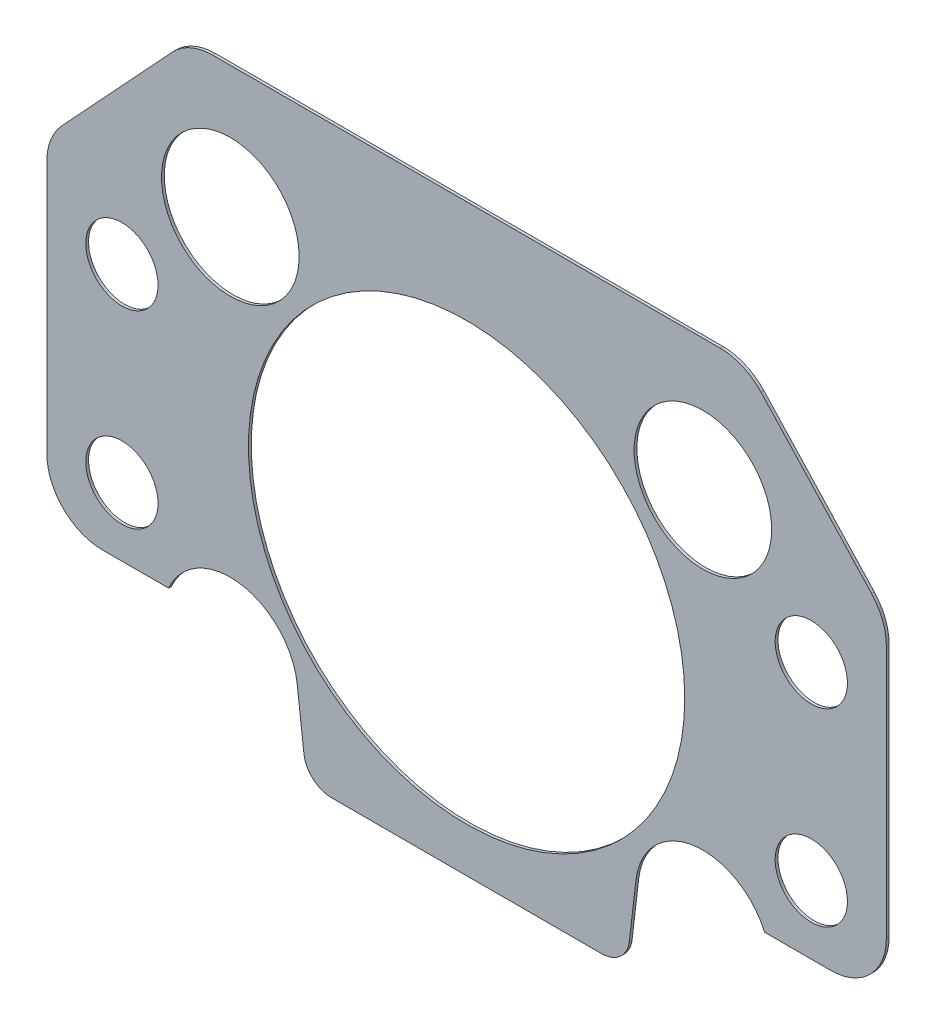
from build123d import *

# Parameters (mm, degrees)
SKETCH1_R           = 24.75
SKETCH1_R_2         = 13
SKETCH1_R_3         = 78.475
BOSS_EXTRUDE1_DEPTH = 1


with BuildPart() as part:
    # Sketch1 → Boss-Extrude1 (new body)
    with BuildSketch(Plane.XY):
        with BuildLine():
            Line((-2.561737691, 115.5), (-91.270303138, 115.5))
            ThreePointArc((-91.270303138, 115.5), (-99.271058557, 113.829973069), (-105.935666275, 109.098791272))
            Line((-105.935666275, 109.098791272), (-145.665363137, 66.253039754))
            ThreePointArc((-145.665363137, 66.253039754), (-149.618636668, 59.958108327), (-151, 52.654248482))
            Line((-151, 52.654248482), (-151, -38.5))
            ThreePointArc((-151, -38.5), (-145.142135624, -52.642135624), (-131, -58.5))
            Line((-131, -58.5), (-107.203603311, -58.5))
            ThreePointArc((-107.203603311, -58.5), (-81.413958175, -44.266614), (-60.915571747, -65.421075164))
            Line((-60.915571747, -65.421075164), (-58.537563271, -85.666566943))
            ThreePointArc((-58.537563271, -85.666566943), (-55.251678473, -91.972137225), (-48.60584028, -94.5))
            Line((-48.60584028, -94.5), (48.60584028, -94.5))
            ThreePointArc((48.60584028, -94.5), (55.251678473, -91.972137225), (58.537563271, -85.666566943))
            Line((58.537563271, -85.666566943), (60.915571747, -65.421075164))
            ThreePointArc((60.915571747, -65.421075164), (81.413958175, -44.266614), (107.203603311, -58.5))
            Line((107.203603311, -58.5), (131, -58.5))
            ThreePointArc((131, -58.5), (145.142135624, -52.642135624), (151, -38.5))
            Line((151, -38.5), (151, 52.654248482))
            ThreePointArc((151, 52.654248482), (149.618636668, 59.958108327), (145.665363137, 66.253039754))
            Line((145.665363137, 66.253039754), (105.935666275, 109.098791272))
            ThreePointArc((105.935666275, 109.098791272), (99.271058557, 113.829973069), (91.270303138, 115.5))
            Line((91.270303138, 115.5), (-2.561737691, 115.5))
        make_face()
        with Locations((-85, 68.25)):
            Circle(SKETCH1_R, mode=Mode.SUBTRACT)
        with Locations((85, 68.25)):
            Circle(SKETCH1_R, mode=Mode.SUBTRACT)
        with Locations((124, -34)):
            Circle(SKETCH1_R_2, mode=Mode.SUBTRACT)
        with Locations((124, 34)):
            Circle(SKETCH1_R_2, mode=Mode.SUBTRACT)
        with Locations((-124, 34)):
            Circle(SKETCH1_R_2, mode=Mode.SUBTRACT)
        with Locations((-124, -34)):
            Circle(SKETCH1_R_2, mode=Mode.SUBTRACT)
        Circle(SKETCH1_R_3, mode=Mode.SUBTRACT)
    extrude(amount=BOSS_EXTRUDE1_DEPTH)


solid = part.part
